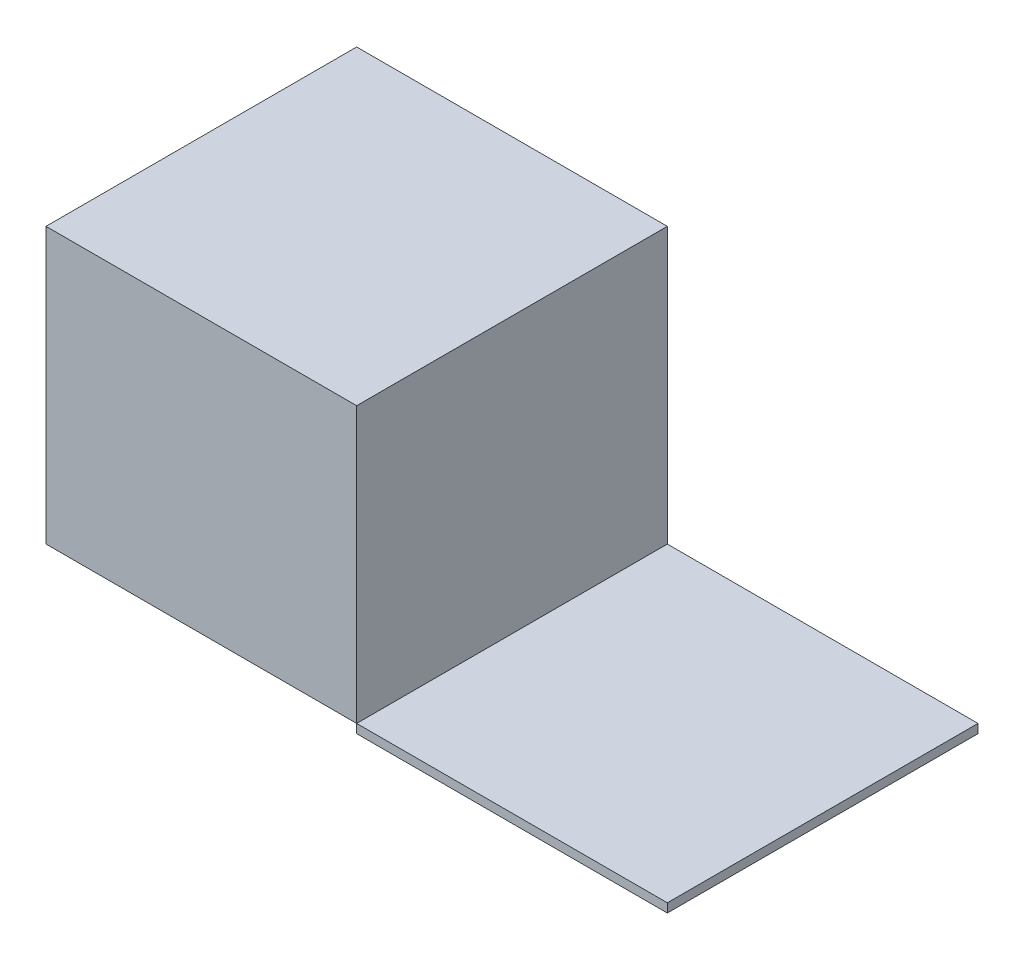
from build123d import *

# Parameters (mm, degrees)
SKETCH1_W           = 35
SKETCH1_H           = 35
SKETCH1_W_2         = 33
SKETCH1_H_2         = 33
BOSS_EXTRUDE1_DEPTH = 30
SKETCH2_W           = 35
SKETCH2_H           = 35
BOSS_EXTRUDE2_DEPTH = 1
SKETCH3_W           = 35
SKETCH3_H           = 35
BOSS_EXTRUDE3_DEPTH = 1


with BuildPart() as part:
    # Sketch1 → Boss-Extrude1 (new body)
    with BuildSketch(Plane(origin=(0, 0, 0), x_dir=(1, 0, 0), z_dir=(0, 1, 0))):
        with Locations((17.5, 17.5)):
            Rectangle(SKETCH1_W, SKETCH1_H)
        with Locations((17.5, 17.5)):
            Rectangle(SKETCH1_W_2, SKETCH1_H_2, mode=Mode.SUBTRACT)
    extrude(amount=BOSS_EXTRUDE1_DEPTH)

    # Sketch2 → Boss-Extrude2 (add)
    with BuildSketch(Plane(origin=(0, 30, 0), x_dir=(1, 0, 0), z_dir=(0, 1, 0))):
        with Locations((17.5, 17.5)):
            Rectangle(SKETCH2_W, SKETCH2_H)
    extrude(amount=BOSS_EXTRUDE2_DEPTH)


with BuildPart() as body_2:
    # Sketch3 → Boss-Extrude3 (new body)
    with BuildSketch(Plane.XZ):
        with Locations((52.5, -17.5)):
            Rectangle(SKETCH3_W, SKETCH3_H)
    extrude(amount=BOSS_EXTRUDE3_DEPTH)


solid = Compound([part.part, body_2.part])
